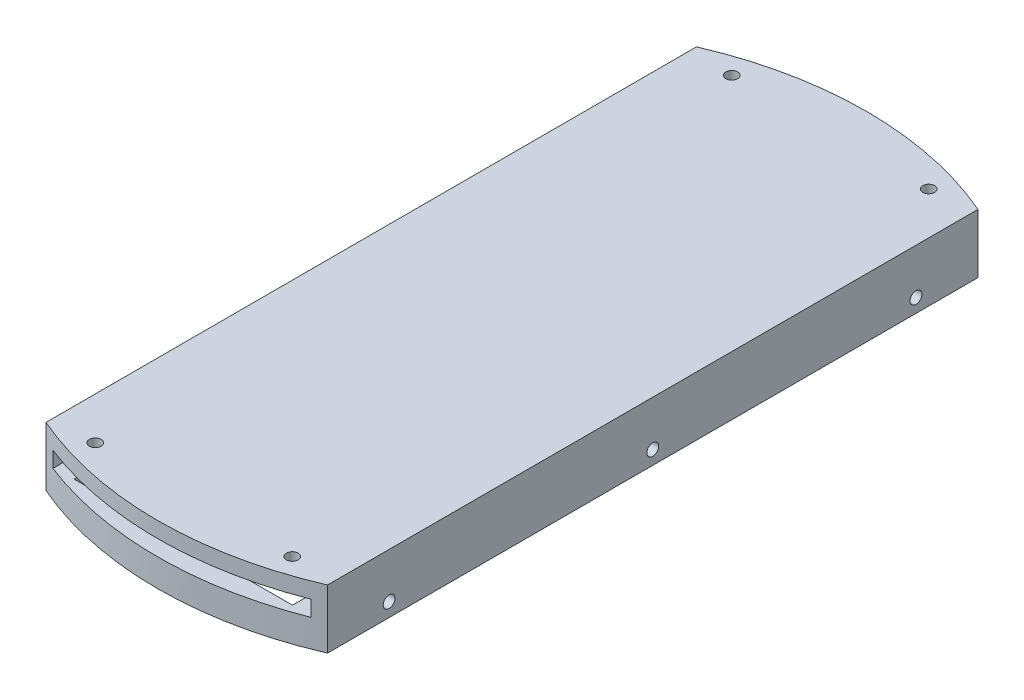
from build123d import *

# Parameters (mm, degrees)
RESSALTO_EXTRUS_O1_DEPTH = 15
CORTE_EXTRUS_O1_DEPTH    = 7
ESBO_O4_W                = 65.5
ESBO_O4_H                = 4
CORTE_EXTRUS_O3_DEPTH    = 14.5
ESBO_O5_W                = 65.5
ESBO_O5_H                = 4
CORTE_EXTRUS_O4_DEPTH    = 14.5
ESBO_O6_R                = 1.5
CORTE_EXTRUS_O5_DEPTH    = 98.99521672
ESBO_O7_R                = 1.5
CORTE_EXTRUS_O6_DEPTH    = 14.5


with BuildPart() as part:
    # Esboço2 → Ressalto-extrusão1 (new body)
    with BuildSketch(Plane(origin=(0, 0, 0), x_dir=(1, 0, 0), z_dir=(0, 1, 0))):
        with BuildLine():
            Line((-35.75, -82.595021036), (-35.75, 82.595021036))
            ThreePointArc((-35.75, 82.595021036), (0, 90), (35.75, 82.595021036))
            Line((35.75, 82.595021036), (35.75, -82.595021036))
            ThreePointArc((35.75, -82.595021036), (0, -90), (-35.75, -82.595021036))
        make_face()
    extrude(amount=RESSALTO_EXTRUS_O1_DEPTH)

    # Esboço3 → Corte-extrusão1 (cut)
    with BuildSketch(Plane(origin=(0, 0, 0), x_dir=(-1, 0, 0), z_dir=(0, -1, 0))):
        Polygon((27.75, 69.5), (27.75, 83.5), (-27.75, 83.5), (-27.75, -83.5), (27.75, -83.5), (27.75, -69.5), (28.75, -69.5), (28.75, -64.4), (27.75, -64.4), (27.75, -2.55), (28.75, -2.55), (28.75, 2.55), (27.75, 2.55), (27.75, 64.4), (28.75, 64.4), (28.75, 69.5), align=None)
    extrude(amount=-CORTE_EXTRUS_O1_DEPTH, mode=Mode.SUBTRACT)

    # Esboço4 → Corte-extrusão3 (cut)
    with BuildSketch(Plane(origin=(0, 0, -90), x_dir=(-1, 0, 0), z_dir=(0, 0, -1))):
        with Locations((0, 9)):
            Rectangle(ESBO_O4_W, ESBO_O4_H)
    extrude(amount=-CORTE_EXTRUS_O3_DEPTH, mode=Mode.SUBTRACT)

    # Esboço5 → Corte-extrusão4 (cut)
    with BuildSketch(Plane.XY.offset(90)):
        with Locations((0, 9)):
            Rectangle(ESBO_O5_W, ESBO_O5_H)
    extrude(amount=-CORTE_EXTRUS_O4_DEPTH, mode=Mode.SUBTRACT)

    # Esboço6 → Corte-extrusão5 (cut, through all)
    with BuildSketch(Plane(origin=(0, 15, 0), x_dir=(1, 0, 0), z_dir=(0, 1, 0))):
        with Locations(Location((-25.01, 80.825021036, 0), (0, 0, 270))):
            Circle(ESBO_O6_R)
        with Locations(Location((25.01, 80.825021036, 0), (0, 0, 270))):
            Circle(ESBO_O6_R)
        with Locations(Location((-25.01, -80.825021036, 0), (0, 0, 270))):
            Circle(ESBO_O6_R)
        with Locations(Location((25.01, -80.825021036, 0), (0, 0, 270))):
            Circle(ESBO_O6_R)
    extrude(amount=-CORTE_EXTRUS_O5_DEPTH, mode=Mode.SUBTRACT)

    # Esboço7 → Corte-extrusão6 (cut)
    with BuildSketch(Plane(origin=(35.75, 0, 0), x_dir=(0, 0, -1), z_dir=(1, 0, 0))):
        with Locations((-66.954978964, 3.5)):
            Circle(ESBO_O7_R)
        with Locations((-0.004978964, 3.5)):
            Circle(ESBO_O7_R)
        with Locations((66.845021036, 3.5)):
            Circle(ESBO_O7_R)
    extrude(amount=-CORTE_EXTRUS_O6_DEPTH, mode=Mode.SUBTRACT)


solid = part.part
